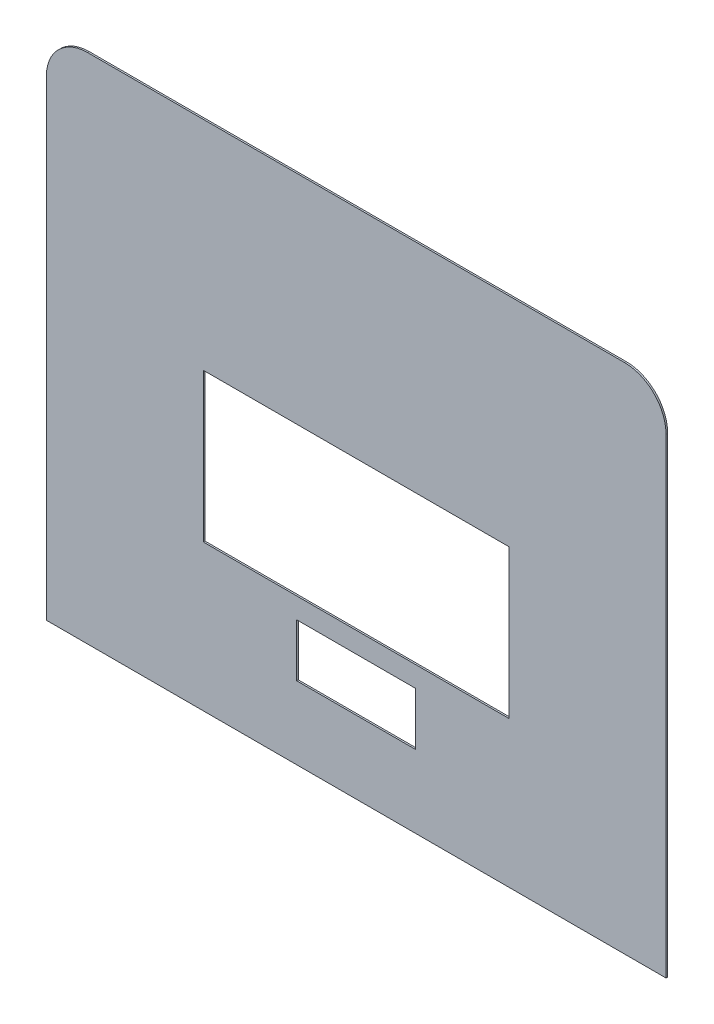
from build123d import *

# Parameters (mm, degrees)
SKETCH1_W           = 144
SKETCH1_H           = 64
SKETCH1_W_2         = 370
SKETCH1_H_2         = 180
BOSS_EXTRUDE1_DEPTH = 1


with BuildPart() as part:
    # Sketch1 → Boss-Extrude1 (new, symmetric)
    with BuildSketch(Plane.XY):
        with BuildLine():
            Line((-325, 310), (325, 310))
            ThreePointArc((325, 310), (360.355339059, 295.355339059), (375, 260))
            Line((375, 260), (375, -310))
            Line((375, -310), (-375, -310))
            Line((-375, -310), (-375, 260))
            ThreePointArc((-375, 260), (-360.355339059, 295.355339059), (-325, 310))
        make_face()
        with Locations((0, -190)):
            Rectangle(SKETCH1_W, SKETCH1_H, mode=Mode.SUBTRACT)
        with Locations((0, -43)):
            Rectangle(SKETCH1_W_2, SKETCH1_H_2, mode=Mode.SUBTRACT)
    extrude(amount=BOSS_EXTRUDE1_DEPTH, both=True)


solid = part.part
